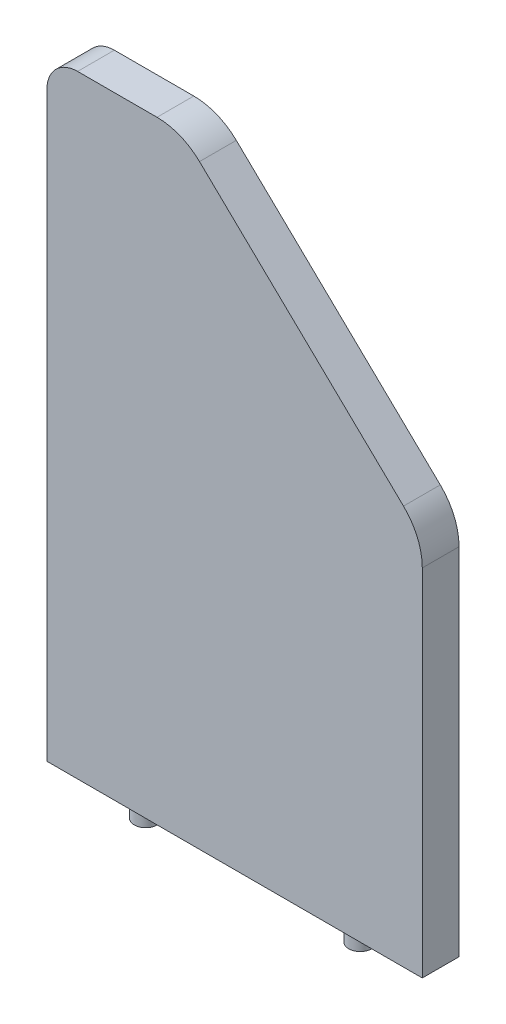
from build123d import *

# Parameters (mm, degrees)
SKETCH4_W                    = 122.5
SKETCH4_H                    = 200
BOSS_EXTRUDE1_DEPTH          = 12
CUT_EXTRUDE1_DEPTH           = 12
FILLET1_R                    = 20
FILLET2_R                    = 20
FILLET3_R                    = 10
SKETCH10_R                   = 3.75
BOSS_EXTRUDE3_DEPTH          = 6
F_5_0_5_DIAMETER_HOLE1_D     = 5
F_5_0_5_DIAMETER_HOLE1_DEPTH = 8
F_5_0_5_DIAMETER_HOLE1_TIP   = 1.502151548
F_5_0_5_DIAMETER_HOLE2_D     = 5
F_5_0_5_DIAMETER_HOLE2_DEPTH = 8
F_5_0_5_DIAMETER_HOLE2_TIP   = 1.502151548
SCALE1_SCALE                 = 0.9


with BuildPart() as part:
    # Sketch4 → Boss-Extrude1 (new body)
    with BuildSketch(Plane.XY):
        with Locations((61.25, 100)):
            Rectangle(SKETCH4_W, SKETCH4_H)
    extrude(amount=BOSS_EXTRUDE1_DEPTH)

    # Sketch7 → Cut-Extrude1 (cut)
    with BuildSketch(Plane.XY.offset(12)):
        Polygon((43.985796602, 200), (122.5, 124.415794753), (122.5, 200), align=None)
    extrude(amount=-CUT_EXTRUDE1_DEPTH, mode=Mode.SUBTRACT)

    # Fillet1
    fillet1_edges = [part.edges().sort_by_distance(p)[0] for p in [
        (43.985796602, 200, 6),
    ]]
    fillet(fillet1_edges, radius=FILLET1_R)

    # Fillet2
    fillet2_edges = [part.edges().sort_by_distance(p)[0] for p in [
        (122.5, 124.415794753, 6),
    ]]
    fillet(fillet2_edges, radius=FILLET2_R)

    # Fillet3
    fillet3_edges = [part.edges().sort_by_distance(p)[0] for p in [
        (0, 200, 6),
    ]]
    fillet(fillet3_edges, radius=FILLET3_R)

    # Sketch10 → Boss-Extrude3 (add)
    with BuildSketch(Plane.XZ):
        with Locations(Location((26.25, 6, 0), (0, 0, 90))):
            Circle(SKETCH10_R)
        with Locations(Location((96.25, 6, 0), (0, 0, 90))):
            Circle(SKETCH10_R)
    extrude(amount=BOSS_EXTRUDE3_DEPTH)

    # Boss-Extrude4 cone 1 section (through the dimple's axis) → Boss-Extrude4 (revolve)
    with BuildSketch(Plane(origin=(26.25, -6, 6), x_dir=(0, 0, 1), z_dir=(1, 0, 0))):
        Polygon((0, 0), (3.75, 0), (0, 1.993910369), align=None)
    revolve(axis=Axis((26.25, -6, 6), (0, -1, 0)))

    # Boss-Extrude4 cone 2 section (through the dimple's axis) → Boss-Extrude4 cone 2 (revolve)
    with BuildSketch(Plane(origin=(96.25, -6, 6), x_dir=(0, 0, 1), z_dir=(1, 0, 0))):
        Polygon((0, 0), (3.75, 0), (0, 1.993910369), align=None)
    revolve(axis=Axis((96.25, -6, 6), (0, -1, 0)))

    # Ø5.0 (5) Diameter Hole1
    with Locations(Plane.ZY):
        with Locations((6, 180)):
            Hole(F_5_0_5_DIAMETER_HOLE1_D / 2, depth=F_5_0_5_DIAMETER_HOLE1_DEPTH)
            with Locations((0, 0, -(F_5_0_5_DIAMETER_HOLE1_DEPTH + F_5_0_5_DIAMETER_HOLE1_TIP / 2))):  # 118° drill point
                Cone(0, F_5_0_5_DIAMETER_HOLE1_D / 2, F_5_0_5_DIAMETER_HOLE1_TIP, mode=Mode.SUBTRACT)

    # Ø5.0 (5) Diameter Hole2
    with Locations(Plane.ZY):
        with Locations((6, 10)):
            Hole(F_5_0_5_DIAMETER_HOLE2_D / 2, depth=F_5_0_5_DIAMETER_HOLE2_DEPTH)
            with Locations((0, 0, -(F_5_0_5_DIAMETER_HOLE2_DEPTH + F_5_0_5_DIAMETER_HOLE2_TIP / 2))):  # 118° drill point
                Cone(0, F_5_0_5_DIAMETER_HOLE2_D / 2, F_5_0_5_DIAMETER_HOLE2_TIP, mode=Mode.SUBTRACT)


with BuildPart() as part_1:
    # Scale1: scaled about (56.525506998, 89.309787592, 6)
    add(part.part.scale(SCALE1_SCALE).moved(Location((5.6525507, 8.930978759, 0.6))))


solid = part_1.part
